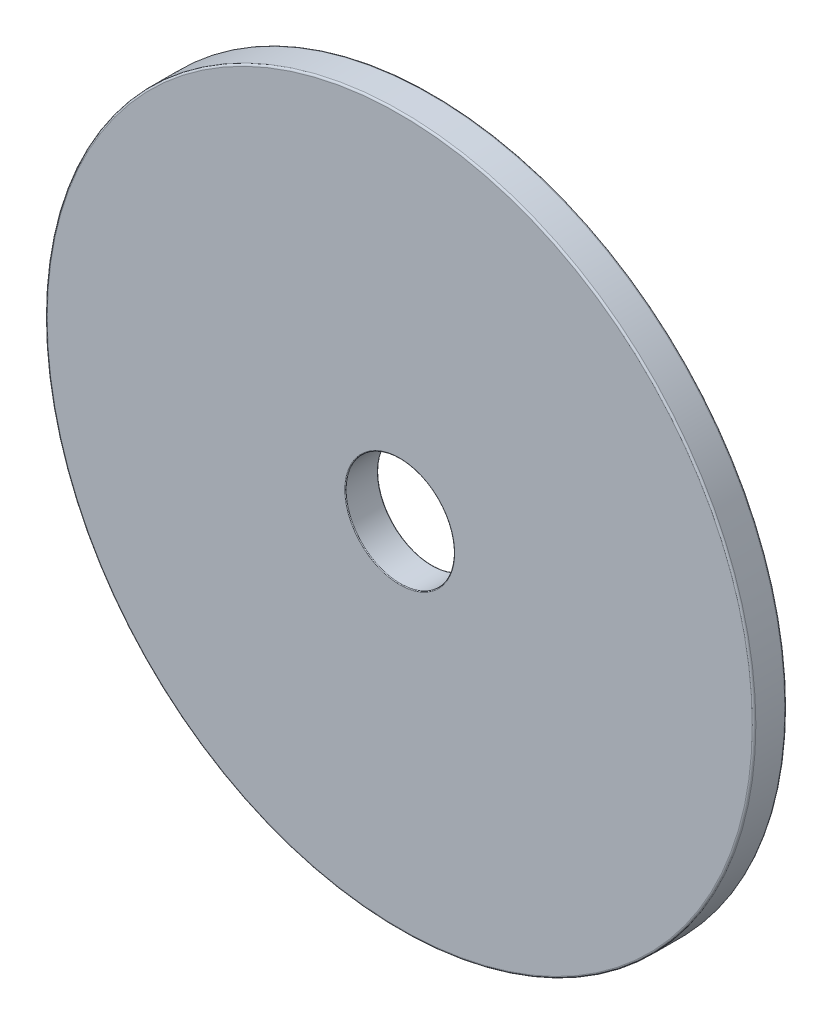
from build123d import *

# Parameters (mm, degrees)
CUT_EXTRUDE1_DEPTH = 20


with BuildPart() as part:
    # Sketch1 → Revolve1 (revolve)
    with BuildSketch(Plane(origin=(0, 0, 0), x_dir=(1, 0, 0), z_dir=(0, 1, 0))):
        with BuildLine():
            Line((-490, 20), (-490, -20))
            ThreePointArc((-490, -20), (-489.267766953, -21.767766953), (-487.5, -22.5))
            Line((-487.5, -22.5), (-150, -22.5))
            Line((-150, -22.5), (-76, -22.5))
            ThreePointArc((-76, -22.5), (-75.292893219, -22.207106781), (-75, -21.5))
            Line((-75, -21.5), (-75, 21.5))
            ThreePointArc((-75, 21.5), (-75.292893219, 22.207106781), (-76, 22.5))
            Line((-76, 22.5), (-150, 22.5))
            Line((-150, 22.5), (-229, 22.5))
            ThreePointArc((-229, 22.5), (-229.707106781, 22.207106781), (-230, 21.5))
            Line((-230, 21.5), (-230, 13.5))
            ThreePointArc((-230, 13.5), (-230.292893219, 12.792893219), (-231, 12.5))
            Line((-231, 12.5), (-259, 12.5))
            ThreePointArc((-259, 12.5), (-259.707106781, 12.792893219), (-260, 13.5))
            Line((-260, 13.5), (-260, 21.5))
            ThreePointArc((-260, 21.5), (-260.292893219, 22.207106781), (-261, 22.5))
            Line((-261, 22.5), (-487.5, 22.5))
            ThreePointArc((-487.5, 22.5), (-489.267766953, 21.767766953), (-490, 20))
        make_face()
    revolve(axis=Axis((0, 0, -58.854483289), (0, 0, 1)))

    # Sketch6 → Cut-Extrude1 (cut)
    with BuildSketch(Plane(origin=(0, 0, -22.5), x_dir=(-1, 0, 0), z_dir=(0, 0, -1))):
        with BuildLine():
            Line((-456.449742496, 57.040622151), (-357.302515171, 43.987642045))
            ThreePointArc((-357.302515171, 43.987642045), (-360, 0), (-357.302515171, -43.987642045))
            Line((-357.302515171, -43.987642045), (-456.449742496, -57.040622151))
            ThreePointArc((-456.449742496, -57.040622151), (-460, 0), (-456.449742496, 57.040622151))
        make_face()
        with BuildLine():
            Line((-423.817383628, -178.826243417), (-331.426875996, -140.556842122))
            ThreePointArc((-331.426875996, -140.556842122), (-311.769145362, -180), (-287.439233951, -216.745673049))
            Line((-287.439233951, -216.745673049), (-366.776761477, -277.623499079))
            ThreePointArc((-366.776761477, -277.623499079), (-398.371685741, -230), (-423.817383628, -178.826243417))
        make_face()
        with BuildLine():
            Line((-426.133395323, 173.234896574), (-333.742887691, 134.965495278))
            ThreePointArc((-333.742887691, 134.965495278), (-347.733297464, 93.174856237), (-356.512566712, 49.9878963))
            Line((-356.512566712, 49.9878963), (-455.659794037, 63.040876407))
            ThreePointArc((-455.659794037, 63.040876407), (-444.325880093, 119.056760747), (-426.133395323, 173.234896574))
        make_face()
        with BuildLine():
            Line((-366.776761477, 277.623499079), (-287.439233951, 216.745673049))
            ThreePointArc((-287.439233951, 216.745673049), (-311.769145362, 180), (-331.426875996, 140.556842122))
            Line((-331.426875996, 140.556842122), (-423.817383628, 178.826243417))
            ThreePointArc((-423.817383628, 178.826243417), (-398.371685741, 230), (-366.776761477, 277.623499079))
        make_face()
        with BuildLine():
            Line((-282.424897463, 363.092518916), (-221.547071434, 283.754991391))
            ThreePointArc((-221.547071434, 283.754991391), (-254.558441227, 254.558441227), (-283.754991391, 221.547071434))
            Line((-283.754991391, 221.547071434), (-363.092518916, 282.424897463))
            ThreePointArc((-363.092518916, 282.424897463), (-325.269119346, 325.269119346), (-282.424897463, 363.092518916))
        make_face()
        with BuildLine():
            Line((-178.826243417, 423.817383628), (-140.556842122, 331.426875996))
            ThreePointArc((-140.556842122, 331.426875996), (-180, 311.769145362), (-216.745673049, 287.439233951))
            Line((-216.745673049, 287.439233951), (-277.623499079, 366.776761477))
            ThreePointArc((-277.623499079, 366.776761477), (-230, 398.371685741), (-178.826243417, 423.817383628))
        make_face()
        with BuildLine():
            Line((-63.040876407, 455.659794037), (-49.9878963, 356.512566712))
            ThreePointArc((-49.9878963, 356.512566712), (-93.174856237, 347.733297464), (-134.965495278, 333.742887691))
            Line((-134.965495278, 333.742887691), (-173.234896574, 426.133395323))
            ThreePointArc((-173.234896574, 426.133395323), (-119.056760747, 444.325880093), (-63.040876407, 455.659794037))
        make_face()
        with BuildLine():
            Line((57.040622151, 456.449742496), (43.987642045, 357.302515171))
            ThreePointArc((43.987642045, 357.302515171), (0, 360), (-43.987642045, 357.302515171))
            Line((-43.987642045, 357.302515171), (-57.040622151, 456.449742496))
            ThreePointArc((-57.040622151, 456.449742496), (0, 460), (57.040622151, 456.449742496))
        make_face()
        with BuildLine():
            Line((173.234896574, 426.133395323), (134.965495278, 333.742887691))
            ThreePointArc((134.965495278, 333.742887691), (93.174856237, 347.733297464), (49.9878963, 356.512566712))
            Line((49.9878963, 356.512566712), (63.040876407, 455.659794037))
            ThreePointArc((63.040876407, 455.659794037), (119.056760747, 444.325880093), (173.234896574, 426.133395323))
        make_face()
        with BuildLine():
            Line((277.623499079, 366.776761477), (216.745673049, 287.439233951))
            ThreePointArc((216.745673049, 287.439233951), (180, 311.769145362), (140.556842122, 331.426875996))
            Line((140.556842122, 331.426875996), (178.826243417, 423.817383628))
            ThreePointArc((178.826243417, 423.817383628), (230, 398.371685741), (277.623499079, 366.776761477))
        make_face()
        with BuildLine():
            Line((363.092518916, 282.424897463), (283.754991391, 221.547071434))
            ThreePointArc((283.754991391, 221.547071434), (254.558441227, 254.558441227), (221.547071434, 283.754991391))
            Line((221.547071434, 283.754991391), (282.424897463, 363.092518916))
            ThreePointArc((282.424897463, 363.092518916), (325.269119346, 325.269119346), (363.092518916, 282.424897463))
        make_face()
        with BuildLine():
            Line((423.817383628, 178.826243417), (331.426875996, 140.556842122))
            ThreePointArc((331.426875996, 140.556842122), (311.769145362, 180), (287.439233951, 216.745673049))
            Line((287.439233951, 216.745673049), (366.776761477, 277.623499079))
            ThreePointArc((366.776761477, 277.623499079), (398.371685741, 230), (423.817383628, 178.826243417))
        make_face()
        with BuildLine():
            Line((455.659794037, 63.040876407), (356.512566712, 49.9878963))
            ThreePointArc((356.512566712, 49.9878963), (347.733297464, 93.174856237), (333.742887691, 134.965495278))
            Line((333.742887691, 134.965495278), (426.133395323, 173.234896574))
            ThreePointArc((426.133395323, 173.234896574), (444.325880093, 119.056760747), (455.659794037, 63.040876407))
        make_face()
        with BuildLine():
            Line((456.449742496, -57.040622151), (357.302515171, -43.987642045))
            ThreePointArc((357.302515171, -43.987642045), (360, 0), (357.302515171, 43.987642045))
            Line((357.302515171, 43.987642045), (456.449742496, 57.040622151))
            ThreePointArc((456.449742496, 57.040622151), (460, 0), (456.449742496, -57.040622151))
        make_face()
        with BuildLine():
            Line((426.133395323, -173.234896574), (333.742887691, -134.965495278))
            ThreePointArc((333.742887691, -134.965495278), (347.733297464, -93.174856237), (356.512566712, -49.9878963))
            Line((356.512566712, -49.9878963), (455.659794037, -63.040876407))
            ThreePointArc((455.659794037, -63.040876407), (444.325880093, -119.056760747), (426.133395323, -173.234896574))
        make_face()
        with BuildLine():
            Line((366.776761477, -277.623499079), (287.439233951, -216.745673049))
            ThreePointArc((287.439233951, -216.745673049), (311.769145362, -180), (331.426875996, -140.556842122))
            Line((331.426875996, -140.556842122), (423.817383628, -178.826243417))
            ThreePointArc((423.817383628, -178.826243417), (398.371685741, -230), (366.776761477, -277.623499079))
        make_face()
        with BuildLine():
            Line((282.424897463, -363.092518916), (221.547071434, -283.754991391))
            ThreePointArc((221.547071434, -283.754991391), (254.558441227, -254.558441227), (283.754991391, -221.547071434))
            Line((283.754991391, -221.547071434), (363.092518916, -282.424897463))
            ThreePointArc((363.092518916, -282.424897463), (325.269119346, -325.269119346), (282.424897463, -363.092518916))
        make_face()
        with BuildLine():
            Line((178.826243417, -423.817383628), (140.556842122, -331.426875996))
            ThreePointArc((140.556842122, -331.426875996), (180, -311.769145362), (216.745673049, -287.439233951))
            Line((216.745673049, -287.439233951), (277.623499079, -366.776761477))
            ThreePointArc((277.623499079, -366.776761477), (230, -398.371685741), (178.826243417, -423.817383628))
        make_face()
        with BuildLine():
            Line((63.040876407, -455.659794037), (49.9878963, -356.512566712))
            ThreePointArc((49.9878963, -356.512566712), (93.174856237, -347.733297464), (134.965495278, -333.742887691))
            Line((134.965495278, -333.742887691), (173.234896574, -426.133395323))
            ThreePointArc((173.234896574, -426.133395323), (119.056760747, -444.325880093), (63.040876407, -455.659794037))
        make_face()
        with BuildLine():
            Line((-57.040622151, -456.449742496), (-43.987642045, -357.302515171))
            ThreePointArc((-43.987642045, -357.302515171), (0, -360), (43.987642045, -357.302515171))
            Line((43.987642045, -357.302515171), (57.040622151, -456.449742496))
            ThreePointArc((57.040622151, -456.449742496), (0, -460), (-57.040622151, -456.449742496))
        make_face()
        with BuildLine():
            Line((-173.234896574, -426.133395323), (-134.965495278, -333.742887691))
            ThreePointArc((-134.965495278, -333.742887691), (-93.174856237, -347.733297464), (-49.9878963, -356.512566712))
            Line((-49.9878963, -356.512566712), (-63.040876407, -455.659794037))
            ThreePointArc((-63.040876407, -455.659794037), (-119.056760747, -444.325880093), (-173.234896574, -426.133395323))
        make_face()
        with BuildLine():
            Line((-277.623499079, -366.776761477), (-216.745673049, -287.439233951))
            ThreePointArc((-216.745673049, -287.439233951), (-180, -311.769145362), (-140.556842122, -331.426875996))
            Line((-140.556842122, -331.426875996), (-178.826243417, -423.817383628))
            ThreePointArc((-178.826243417, -423.817383628), (-230, -398.371685741), (-277.623499079, -366.776761477))
        make_face()
        with BuildLine():
            Line((-363.092518916, -282.424897463), (-283.754991391, -221.547071434))
            ThreePointArc((-283.754991391, -221.547071434), (-254.558441227, -254.558441227), (-221.547071434, -283.754991391))
            Line((-221.547071434, -283.754991391), (-282.424897463, -363.092518916))
            ThreePointArc((-282.424897463, -363.092518916), (-325.269119346, -325.269119346), (-363.092518916, -282.424897463))
        make_face()
        with BuildLine():
            Line((-455.659794037, -63.040876407), (-356.512566712, -49.9878963))
            ThreePointArc((-356.512566712, -49.9878963), (-347.733297464, -93.174856237), (-333.742887691, -134.965495278))
            Line((-333.742887691, -134.965495278), (-426.133395323, -173.234896574))
            ThreePointArc((-426.133395323, -173.234896574), (-444.325880093, -119.056760747), (-455.659794037, -63.040876407))
        make_face()
    extrude(amount=-CUT_EXTRUDE1_DEPTH, mode=Mode.SUBTRACT)


solid = part.part
